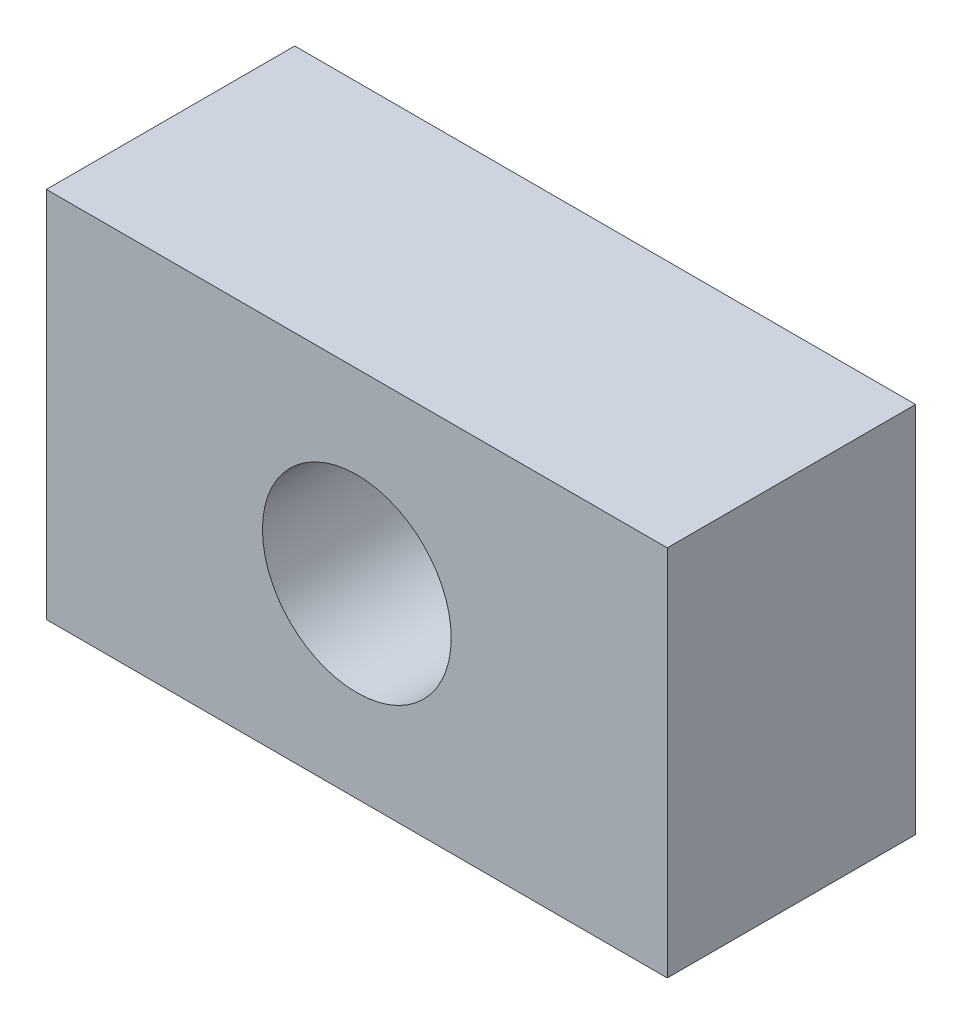
from build123d import *

# Parameters (mm, degrees)
SKETCH1_W           = 63.5
SKETCH1_H           = 38.1
BOSS_EXTRUDE1_DEPTH = 25.4
SKETCH2_R           = 9.652
CUT_EXTRUDE1_DEPTH  = 22.86


with BuildPart() as part:
    # Sketch1 → Boss-Extrude1 (new body)
    with BuildSketch(Plane.XY):
        with Locations((31.75, -19.05)):
            Rectangle(SKETCH1_W, SKETCH1_H)
    extrude(amount=BOSS_EXTRUDE1_DEPTH)

    # Sketch2 → Cut-Extrude1 (cut)
    with BuildSketch(Plane.XY.offset(25.4)):
        with Locations((31.75, -19.05)):
            Circle(SKETCH2_R)
    extrude(amount=-CUT_EXTRUDE1_DEPTH, mode=Mode.SUBTRACT)


solid = part.part
